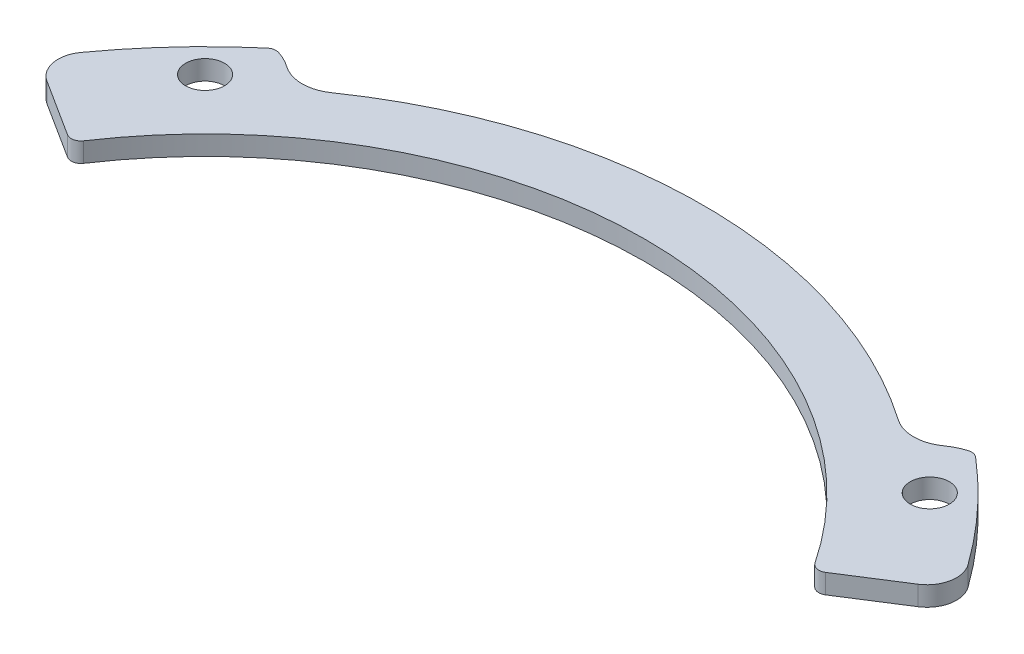
from build123d import *

# Parameters (mm, degrees)
SKETCH_1_R          = 2
EXTRUDE_1_DEPTH     = 2
CUT_EXTRUDE_1_DEPTH = 73.508544139
FILLET_1_R          = 1


with BuildPart() as part:
    # 草图1 → 凸台-拉伸1 (new body)
    with BuildSketch(Plane(origin=(0, 0, 0), x_dir=(1, 0, 0), z_dir=(0, 1, 0))):
        with BuildLine():
            Line((-37.994784634, 24.205347356), (-44.62808047, 28.431222864))
            ThreePointArc((-44.62808047, 28.431222864), (-45.962279794, 30.395264974), (-45.451059851, 32.713929119))
            ThreePointArc((-45.451059851, 32.713929119), (0, 56), (45.451059851, 32.713929119))
            ThreePointArc((45.451059851, 32.713929119), (45.962279794, 30.395264974), (44.62808047, 28.431222864))
            Line((44.62808047, 28.431222864), (37.994784634, 24.205347356))
            ThreePointArc((37.994784634, 24.205347356), (0, 45.05), (-37.994784634, 24.205347356))
        make_face()
        with Locations(Location((37.123106012, 37.123106012, 0), (0, 0, 270))):
            Circle(SKETCH_1_R, mode=Mode.SUBTRACT)
        with Locations(Location((-37.123106012, 37.123106012, 0), (0, 0, 270))):
            Circle(SKETCH_1_R, mode=Mode.SUBTRACT)
    extrude(amount=EXTRUDE_1_DEPTH)

    # 草图2 → 切除-拉伸1 (cut, through all)
    with BuildSketch(Plane(origin=(0, 2, 0), x_dir=(1, 0, 0), z_dir=(0, 1, 0))):
        with BuildLine():
            ThreePointArc((-29.047558943, 41.980255114), (0, 51.05), (29.047558943, 41.980255114))
            ThreePointArc((29.047558943, 41.980255114), (31.350327582, 41.269688809), (33.643382893, 42.011001982))
            ThreePointArc((33.643382893, 42.011001982), (34.712414977, 42.617518513), (35.882608489, 42.993469365))
            ThreePointArc((35.882608489, 42.993469365), (0, 56), (-35.882608489, 42.993469365))
            ThreePointArc((-35.882608489, 42.993469365), (-34.712414977, 42.617518513), (-33.643382893, 42.011001982))
            ThreePointArc((-33.643382893, 42.011001982), (-31.350327582, 41.269688809), (-29.047558943, 41.980255114))
        make_face()
    extrude(amount=-CUT_EXTRUDE_1_DEPTH, mode=Mode.SUBTRACT)

    # 圆角1
    fillet_1_edges = [part.edges().sort_by_distance(p)[0] for p in [
        (-37.994784634, 1, -24.205347356),
        (37.994784634, 1, -24.205347356),
        (-35.882608489, 1, -42.993469365),
        (35.882608489, 1, -42.993469365),
    ]]
    fillet(fillet_1_edges, radius=FILLET_1_R)


solid = part.part
